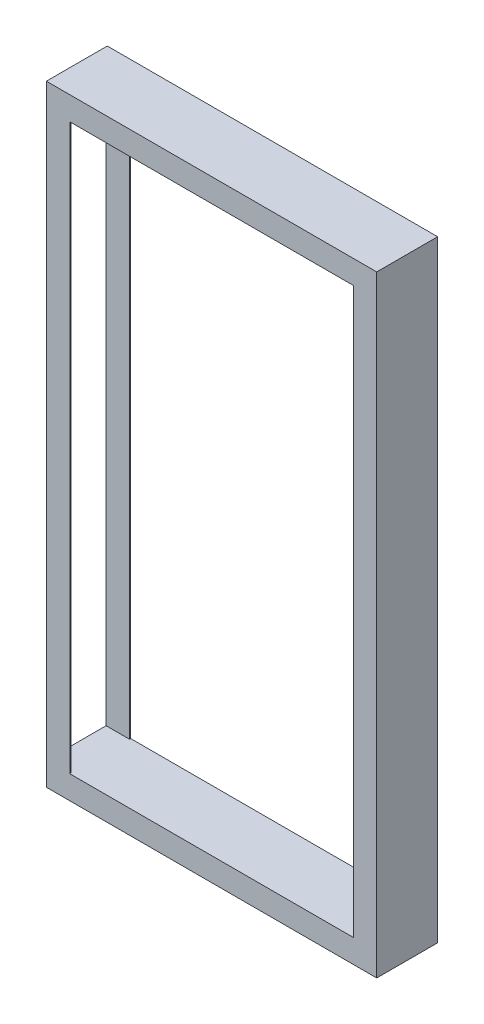
from build123d import *

# Parameters (mm, degrees)
SKETCH2_W           = 261
SKETCH2_H           = 141
SKETCH2_W_2         = 241
SKETCH2_H_2         = 121
BOSS_EXTRUDE1_DEPTH = 26
SKETCH4_W           = 241
SKETCH4_H           = 25
CUT_EXTRUDE1_DEPTH  = 187.727742984


with BuildPart() as part:
    # Sketch2 → Boss-Extrude1 (new body)
    with BuildSketch(Plane(origin=(0, 0, 0), x_dir=(0, 1, 0), z_dir=(0, 0, 1))):
        Rectangle(SKETCH2_W, SKETCH2_H)
        Rectangle(SKETCH2_W_2, SKETCH2_H_2, mode=Mode.SUBTRACT)
    extrude(amount=BOSS_EXTRUDE1_DEPTH)

    # Sketch4 → Cut-Extrude1 (cut, through all)
    with BuildSketch(Plane.YZ.offset(-60.5)):
        with Locations((0, 13)):
            Rectangle(SKETCH4_W, SKETCH4_H)
    extrude(amount=-CUT_EXTRUDE1_DEPTH, mode=Mode.SUBTRACT)


solid = part.part
